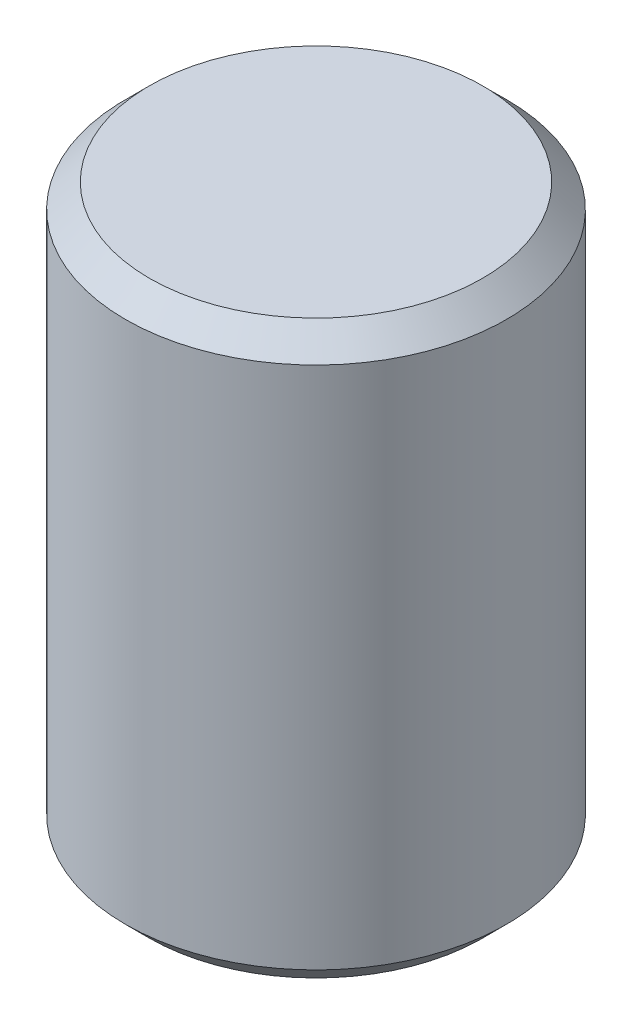
from build123d import *

# Parameters (mm, degrees)
SKETCH1_R           = 4
BOSS_EXTRUDE1_DEPTH = 6
CHAMFER1_SIZE       = 0.5


with BuildPart() as part:
    # Sketch1 → Boss-Extrude1 (new, symmetric)
    with BuildSketch(Plane(origin=(0, 0, 0), x_dir=(1, 0, 0), z_dir=(0, 1, 0))):
        with Locations(Location((0, 0, 0), (0, 0, 270))):
            Circle(SKETCH1_R)
    extrude(amount=BOSS_EXTRUDE1_DEPTH, both=True)

    # Chamfer1
    chamfer1_edges = [part.edges().sort_by_distance(p)[0] for p in [
        (0, -6, -4),
        (0, 6, -4),
    ]]
    chamfer(chamfer1_edges, length=CHAMFER1_SIZE)


solid = part.part
